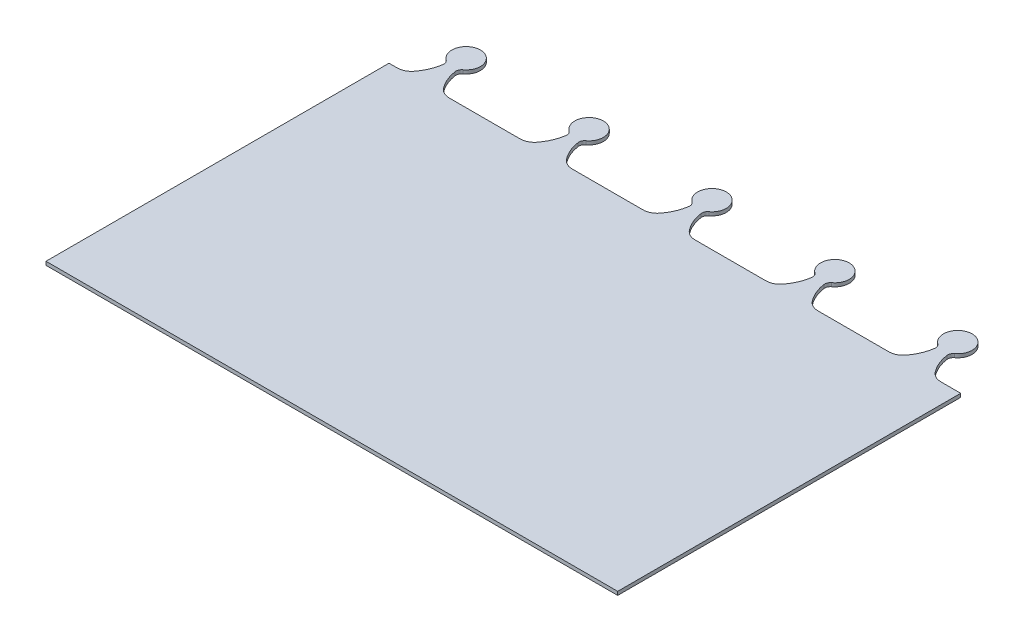
from build123d import *

# Parameters (mm, degrees)
BOSS_EXTRUDE1_DEPTH = 3.175
BOSS_EXTRUDE2_DEPTH = 3.175
LPATTERN1_COUNT     = 5
LPATTERN1_PITCH     = 109.22


with BuildPart() as part:
    # Sketch1 → Boss-Extrude1 (new body)
    with BuildSketch(Plane(origin=(0, 0, 0), x_dir=(1, 0, 0), z_dir=(0, 1, 0))):
        Polygon((0, 304.8), (0, 0), (508, 0), (508, 304.8), (53.593132378, 304.8), (7.268244995, 304.8), align=None)
    extrude(amount=BOSS_EXTRUDE1_DEPTH)

    # Sketch1<3> → Boss-Extrude2 (add)
    with BuildSketch(Plane(origin=(0, 0, 0), x_dir=(1, 0, 0), z_dir=(0, 1, 0))):
        with BuildLine():
            ThreePointArc((17.252367493, 309.650968343), (12.818348506, 306.076937756), (7.268244995, 304.8))
            Line((7.268244995, 304.8), (53.593132378, 304.8))
            ThreePointArc((53.593132378, 304.8), (48.043028868, 306.076937756), (43.609009881, 309.650968343))
            ThreePointArc((43.609009881, 309.650968343), (38.533476821, 318.209528266), (35.84709227, 327.790411412))
            ThreePointArc((35.84709227, 327.790411412), (36.197138958, 330.490776765), (37.891385065, 332.62245119))
            ThreePointArc((37.891385065, 332.62245119), (30.430688687, 355.6), (22.969992308, 332.62245119))
            ThreePointArc((22.969992308, 332.62245119), (24.664238415, 330.490776765), (25.014285104, 327.790411412))
            ThreePointArc((25.014285104, 327.790411412), (22.327900553, 318.209528266), (17.252367493, 309.650968343))
        make_face()
    boss_extrude2 = extrude(amount=BOSS_EXTRUDE2_DEPTH)

    # LPattern1: Boss-Extrude2 ×5
    with Locations(*[(i * LPATTERN1_PITCH, 0, 0) for i in range(1, LPATTERN1_COUNT)]):
        add(boss_extrude2)


solid = part.part
